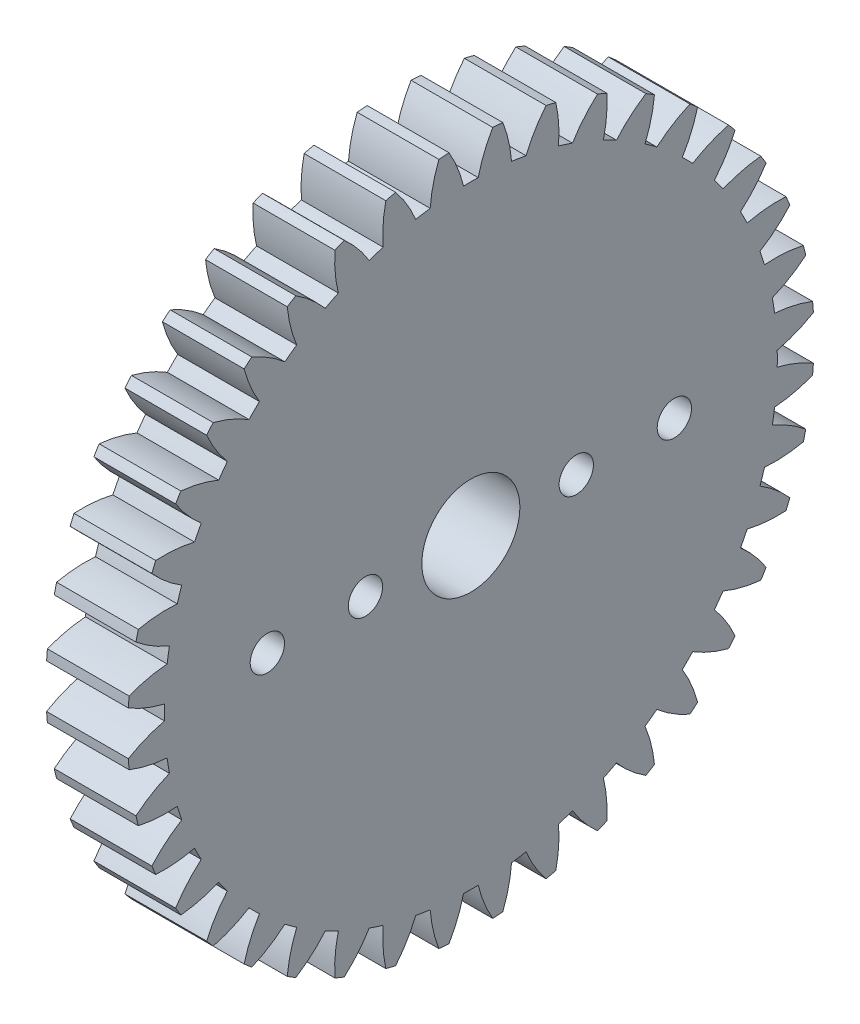
from build123d import *

# Parameters (mm, degrees)
BASPROSKE_W         = 5
BASPROSKE_H         = 21
TOOTHCUT_DEPTH      = 31.116440693
TEETHCUTS_COUNT     = 40
TEETHCUTS_ANGLE     = 351
BORSKE_R            = 0.5
BORE_DEPTH          = 50.0001016
SKETCH_1_R          = 1.05
SKETCH_1_R_2        = 3
CUT_EXTRUDE_1_DEPTH = 31.056738792


with BuildPart() as part:
    # BasProSke → Base-Revolve (revolve)
    with BuildSketch(Plane(origin=(0, 0, 0), x_dir=(1, 0, 0), z_dir=(0, 1, 0)), mode=Mode.PRIVATE) as base_revolve_sk:
        with Locations((2.5, 10.5)):
            Rectangle(BASPROSKE_W, BASPROSKE_H)
    revolve(base_revolve_sk.sketch.rotate(Axis((-10, 0, 0), (1, 0, 0)), 180), axis=Axis((-10, 0, 0), (1, 0, 0)))

    # TooCutSke → ToothCut (cut, through all)
    with BuildSketch(Plane(origin=(0, 0, 0), x_dir=(0, 0, -1), z_dir=(1, 0, 0))):
        with BuildLine():
            ThreePointArc((0.448673268, 18.74363074), (0, 18.749), (-0.448673268, 18.74363074))
            ThreePointArc((-0.448673268, 18.74363074), (-0.816786816, 19.89705013), (-1.354745081, 20.981708961))
            ThreePointArc((-1.354745081, 20.981708961), (0, 21.0254), (1.354745081, 20.981708961))
            ThreePointArc((1.354745081, 20.981708961), (0.816786816, 19.89705013), (0.448673268, 18.74363074))
        make_face()
    toothcut = extrude(amount=TOOTHCUT_DEPTH, mode=Mode.SUBTRACT)

    # TeethCuts: ToothCut ×40 about axis
    teethcuts_axis = Axis((-10, 0, 0), (1, 0, 0))
    for i in range(1, TEETHCUTS_COUNT):
        add(toothcut.rotate(teethcuts_axis, i * TEETHCUTS_ANGLE / (TEETHCUTS_COUNT - 1)), mode=Mode.SUBTRACT)

    # BorSke → Bore (cut, symmetric)
    with BuildSketch(Plane(origin=(0, 0, 0), x_dir=(0, 0, -1), z_dir=(1, 0, 0))):
        with Locations(Location((0, 0, 0), (0, 0, 180))):
            Circle(BORSKE_R)
    extrude(amount=BORE_DEPTH, both=True, mode=Mode.SUBTRACT)

    # ｽｹｯﾁ1 → ｶｯﾄ - 押し出し1 (cut, through all)
    with BuildSketch(Plane(origin=(5, 0, 0), x_dir=(0, 0, -1), z_dir=(1, 0, 0))):
        with Locations((-12.45, 0)):
            Circle(SKETCH_1_R)
        with Locations((-6.45, 0)):
            Circle(SKETCH_1_R)
        Circle(SKETCH_1_R_2)
        with Locations(Location((6.45, 0, 0), (0, 0, 180))):
            Circle(SKETCH_1_R)
        with Locations(Location((12.45, 0, 0), (0, 0, 180))):
            Circle(SKETCH_1_R)
    extrude(amount=-CUT_EXTRUDE_1_DEPTH, mode=Mode.SUBTRACT)


solid = part.part
